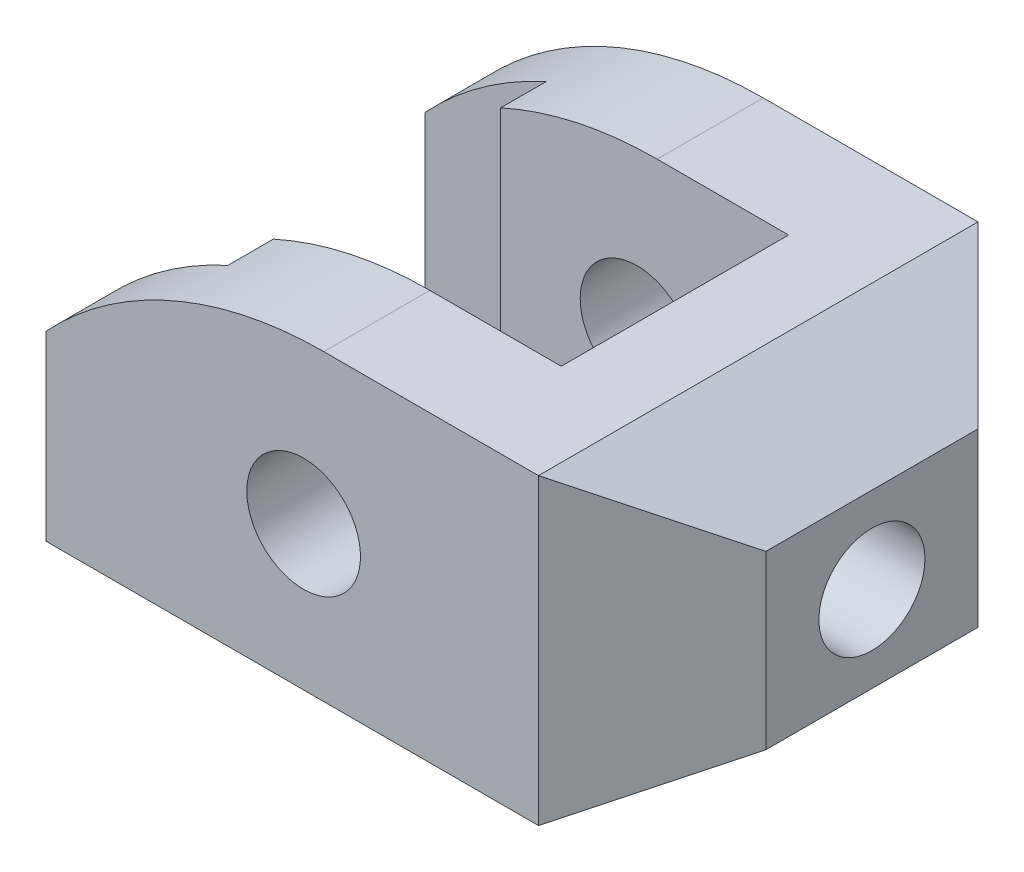
from build123d import *

# Parameters (mm, degrees)
SKETCH3_R           = 7.5
BOSS_EXTRUDE2_DEPTH = 58
CUT_EXTRUDE6_DEPTH  = 58
CUT_EXTRUDE9_DEPTH  = 29
SKETCH10_R          = 7
CUT_EXTRUDE10_DEPTH = 99


with BuildPart() as part:
    # Sketch3 → Boss-Extrude2 (new body)
    with BuildSketch(Plane.XY):
        with BuildLine():
            Line((-34, 5), (-34, -19))
            Line((-34, -19), (31, -19))
            Line((31, -19), (46, -10.339745962))
            Line((46, -10.339745962), (46, 12.339745962))
            Line((46, 12.339745962), (31, 21))
            Line((31, 21), (2.66060556, 21))
            ThreePointArc((2.66060556, 21), (-17.33939444, 16.82575695), (-34, 5))
        make_face()
        with Locations(Location((0, 0, 0), (0, 0, 180))):
            Circle(SKETCH3_R, mode=Mode.SUBTRACT)
    extrude(amount=BOSS_EXTRUDE2_DEPTH)

    # Sketch5 → Cut-Extrude6 (cut)
    with BuildSketch(Plane.XZ.offset(19)):
        Polygon((-34, 50), (-18, 50), (-18, 44), (20, 44), (20, 14), (-18, 14), (-18, 8), (-34, 8), align=None)
    extrude(amount=-CUT_EXTRUDE6_DEPTH, mode=Mode.SUBTRACT)

    # Sketch8 → Cut-Extrude9 (cut, symmetric)
    with BuildSketch(Plane(origin=(0, 0, 0), x_dir=(1, 0, 0), z_dir=(0, 1, 0))):
        Polygon((31, 0), (46, 0), (46, -15), align=None)
        Polygon((46, -58), (46, -43), (31, -58), align=None)
    extrude(amount=CUT_EXTRUDE9_DEPTH, both=True, mode=Mode.SUBTRACT)

    # Sketch10 → Cut-Extrude10 (cut, symmetric)
    with BuildSketch(Plane(origin=(46, 0, 0), x_dir=(0, 0, -1), z_dir=(1, 0, 0))):
        with Locations((-29, 1)):
            Circle(SKETCH10_R)
    extrude(amount=CUT_EXTRUDE10_DEPTH, both=True, mode=Mode.SUBTRACT)


solid = part.part
